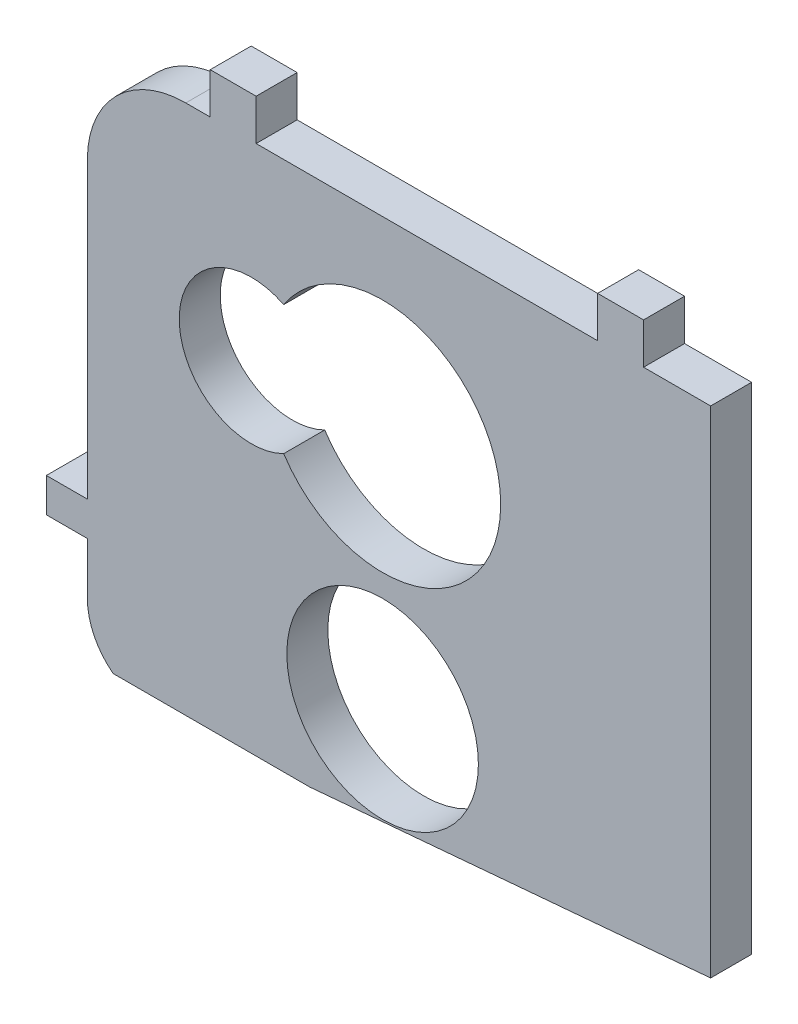
from build123d import *

# Parameters (mm, degrees)
SKETCH1_R           = 3.7084
SKETCH1_W           = 1.778
SKETCH1_H           = 1.5875
SKETCH1_W_2         = 1.5875
SKETCH1_H_2         = 1.3208
BOSS_EXTRUDE1_DEPTH = 1.5875


with BuildPart() as part:
    # Sketch1 → Boss-Extrude1 (new body)
    # profile 1 of 4: a face of its own
    with BuildSketch(Plane.XY):
        with BuildLine():
            Line((-10.431265191, -4.028360607), (-2.823309713, -4.028360607))
            Line((-2.823309713, -4.028360607), (12.7, -2.670246987))
            Line((12.7, -2.670246987), (12.7, 16.51))
            Line((12.7, 16.51), (10.10362126, 16.51))
            Line((10.10362126, 16.51), (8.32562126, 16.51))
            Line((8.32562126, 16.51), (-4.89637874, 16.51))
            Line((-4.89637874, 16.51), (-6.67437874, 16.51))
            Line((-6.67437874, 16.51), (-7.62, 16.51))
            ThreePointArc((-7.62, 16.51), (-10.314076836, 15.394076836), (-11.43, 12.7))
            Line((-11.43, 12.7), (-11.43, 1.3208))
            Line((-11.43, 1.3208), (-11.43, 0))
            Line((-11.43, 0), (-11.43, -2.009424845))
            ThreePointArc((-11.43, -2.009424845), (-11.166665718, -3.135654487), (-10.431265191, -4.028360607))
        make_face()
        Circle(SKETCH1_R, mode=Mode.SUBTRACT)
        with BuildLine():
            ThreePointArc((-3.82905, 11.642311449), (4.572, 9.144), (-3.82905, 6.645688551))
            ThreePointArc((-3.82905, 6.645688551), (-7.874, 9.144), (-3.82905, 11.642311449))
        make_face(mode=Mode.SUBTRACT)
    # profile 2 of 4: a face of its own
    with BuildSketch(Plane.XY):
        with Locations((-5.78537874, 17.30375)):
            Rectangle(SKETCH1_W, SKETCH1_H)
    # profile 3 of 4: a face of its own
    with BuildSketch(Plane.XY):
        with Locations((9.21462126, 17.30375)):
            Rectangle(SKETCH1_W, SKETCH1_H)
    # profile 4 of 4: a face of its own
    with BuildSketch(Plane.XY):
        with Locations((-12.22375, 0.6604)):
            Rectangle(SKETCH1_W_2, SKETCH1_H_2)
    extrude(amount=BOSS_EXTRUDE1_DEPTH)


solid = part.part
